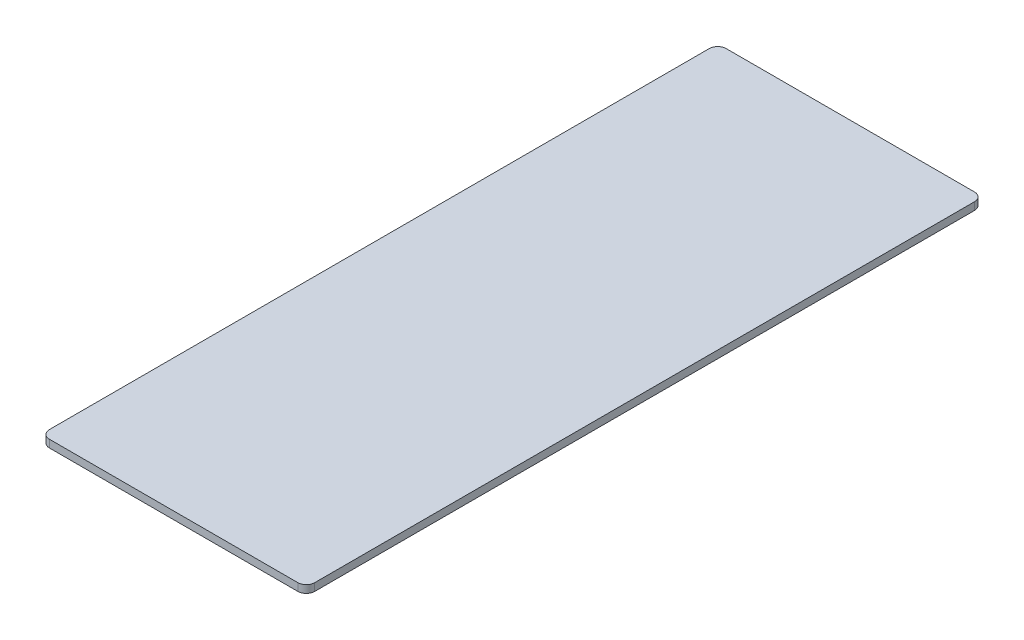
from build123d import *

# Parameters (mm, degrees)
SKETCH1_W           = 156.8
SKETCH1_H           = 400
BOSS_EXTRUDE1_DEPTH = 4.5
FILLET1_R           = 5


with BuildPart() as part:
    # Sketch1 → Boss-Extrude1 (new body)
    with BuildSketch(Plane(origin=(0, 0, 0), x_dir=(1, 0, 0), z_dir=(0, 1, 0))):
        with Locations((78.4, 200)):
            Rectangle(SKETCH1_W, SKETCH1_H)
    extrude(amount=BOSS_EXTRUDE1_DEPTH)

    # Fillet1
    fillet1_edges = [part.edges().sort_by_distance(p)[0] for p in [
        (0, 2.25, -400),
        (156.8, 2.25, -400),
        (156.8, 2.25, 0),
        (0, 2.25, 0),
    ]]
    fillet(fillet1_edges, radius=FILLET1_R)


solid = part.part
